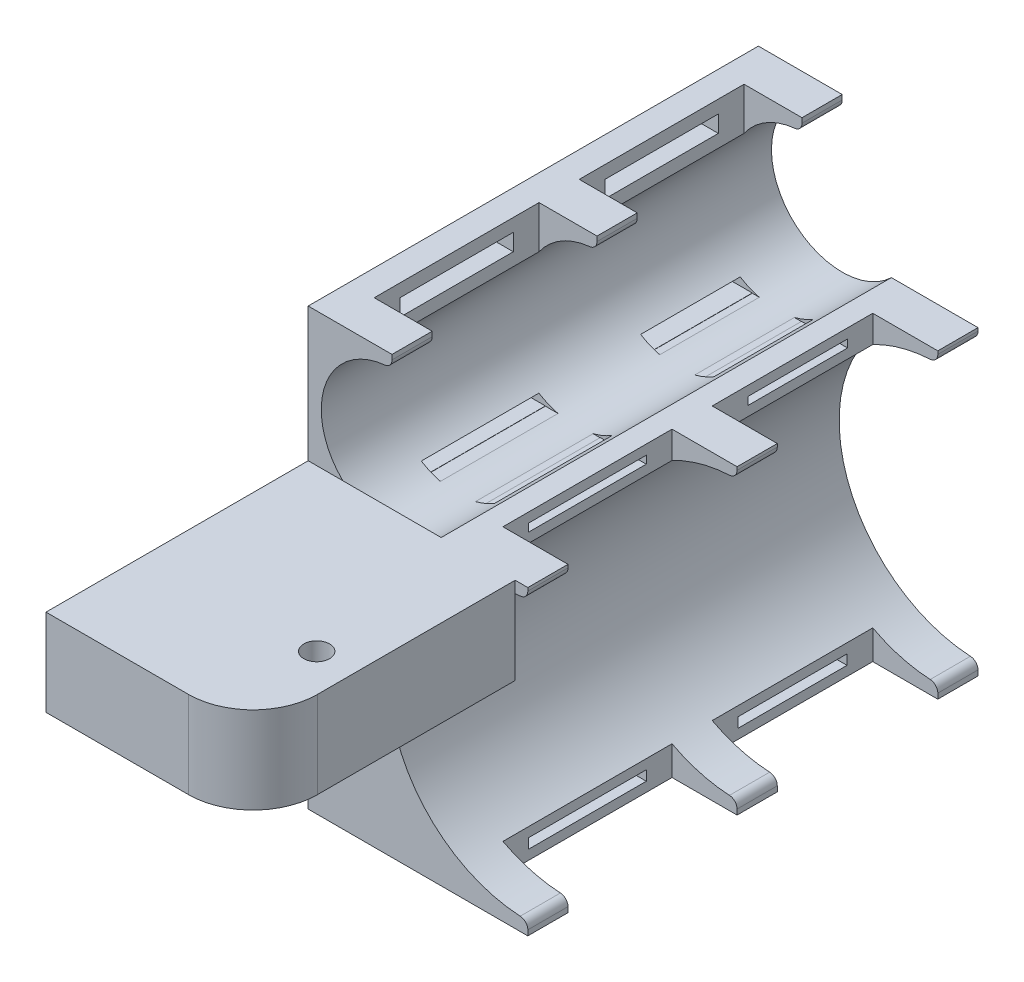
from build123d import *

# Parameters (mm, degrees)
BOSS_EXTRUDE1_DEPTH = 70
SKETCH2_W           = 30.127897987
SKETCH2_H           = 25.625
CUT_EXTRUDE1_DEPTH  = 10
SKETCH3_W           = 36.135462637
SKETCH3_H           = 24.960917338
SKETCH3_H_2         = 26.289082662
CUT_EXTRUDE2_DEPTH  = 88.210896549
SKETCH5_W           = 40.769231001
SKETCH5_H           = 13.5
BOSS_EXTRUDE2_DEPTH = 50
SKETCH6_R           = 2
CUT_EXTRUDE3_DEPTH  = 50
FILLET1_R           = 1.25
FILLET2_R           = 16
SKETCH7_W           = 19.805527333
SKETCH7_H           = 40.769231001
CUT_EXTRUDE4_DEPTH  = 93.57213387
FILLET3_R           = 10
SKETCH9_W           = 15.47666937
SKETCH9_H           = 1.215437552
SKETCH9_W_2         = 18.289082662
SKETCH9_W_3         = 17.625
SKETCH9_H_2         = 2.622507707
SKETCH9_W_4         = 16.960917338
SKETCH9_H_3         = 1.548156683
CUT_EXTRUDE5_DEPTH  = 129.948187004
SKETCH10_W          = 7.652135561
SKETCH10_H          = 15.47666937
SKETCH10_W_2        = 8.528334289
SKETCH10_H_2        = 18.289082662
CUT_EXTRUDE8_DEPTH  = 2.75


with BuildPart() as part:
    # Sketch1 → Boss-Extrude1 (new body)
    with BuildSketch(Plane.XY):
        with BuildLine():
            Line((22.473811518, 84.75800041), (22.473811518, 83.058719541))
            ThreePointArc((22.473811518, 83.058719541), (0.883811518, 61.468719541), (22.473811518, 39.878719541))
            Line((22.473811518, 39.878719541), (22.473811518, 37.846719541))
            Line((22.473811518, 37.846719541), (-11.673355367, 37.846719541))
            Line((-11.673355367, 37.846719541), (-11.673355367, 105.594024014))
            Line((-11.673355367, 105.594024014), (1.358644633, 105.594024014))
            Line((1.358644633, 105.594024014), (1.358644633, 103.665116534))
            ThreePointArc((1.358644633, 103.665116534), (-8.83886186, 88.540693991), (9.005703845, 84.75800041))
            Line((9.005703845, 84.75800041), (22.473811518, 84.75800041))
        make_face()
    extrude(amount=-BOSS_EXTRUDE1_DEPTH)

    # Sketch2 → Cut-Extrude1 (cut)
    with BuildSketch(Plane(origin=(0, 105.594024014, 0), x_dir=(1, 0, 0), z_dir=(0, 1, 0))):
        with Locations((7.409862525, 50.9375)):
            Rectangle(SKETCH2_W, SKETCH2_H)
        with Locations((7.409862525, 19.0625)):
            Rectangle(SKETCH2_W, SKETCH2_H)
    extrude(amount=-CUT_EXTRUDE1_DEPTH, mode=Mode.SUBTRACT)

    # Sketch3 → Cut-Extrude2 (cut, through all)
    with BuildSketch(Plane(origin=(0, 84.75800041, 0), x_dir=(1, 0, 0), z_dir=(0, 1, 0))):
        with Locations((30.426375951, 51.269541331)):
            Rectangle(SKETCH3_W, SKETCH3_H)
        with Locations((30.426375951, 19.394541331)):
            Rectangle(SKETCH3_W, SKETCH3_H_2)
    extrude(amount=-CUT_EXTRUDE2_DEPTH, mode=Mode.SUBTRACT)

    # Sketch5 → Boss-Extrude2 (add)
    with BuildSketch(Plane.ZY.offset(11.673355367)):
        with Locations((20.384615501, 78.00800041)):
            Rectangle(SKETCH5_W, SKETCH5_H)
    extrude(amount=-BOSS_EXTRUDE2_DEPTH)

    # Sketch6 → Cut-Extrude3 (cut)
    with BuildSketch(Plane(origin=(0, 84.75800041, 0), x_dir=(1, 0, 0), z_dir=(0, 1, 0))):
        with Locations(Location((14.647627353, -25, 0), (0, 0, 270))):
            Circle(SKETCH6_R)
        with Locations(Location((30.329421103, -25, 0), (0, 0, 270))):
            Circle(SKETCH6_R)
    extrude(amount=-CUT_EXTRUDE3_DEPTH, mode=Mode.SUBTRACT)

    # Fillet1
    fillet1_edges = [part.edges().sort_by_distance(p)[0] for p in [
        (1.358644633, 103.665116534, -66.875),
        (22.473811518, 83.058719541, -66.875),
        (22.473811518, 39.878719541, -66.875),
        (1.358644633, 103.665116534, -35),
        (1.358644633, 103.665116534, -3.125),
        (22.473811518, 39.878719541, -35.664082662),
        (22.473811518, 39.878719541, -3.125),
        (22.473811518, 83.058719541, -35.664082662),
        (22.473811518, 83.058719541, -3.125),
    ]]
    fillet(fillet1_edges, radius=FILLET1_R)

    # Fillet2
    fillet2_edges = [part.edges().sort_by_distance(p)[0] for p in [
        (38.326644633, 78.00800041, 0),
        (38.326644633, 78.00800041, 40.769231001),
    ]]
    fillet(fillet2_edges, radius=FILLET2_R)

    # Sketch7 → Cut-Extrude4 (cut, through all)
    with BuildSketch(Plane(origin=(0, 84.75800041, 0), x_dir=(1, 0, 0), z_dir=(0, 1, 0))):
        with Locations((30.410801799, -20.384615501)):
            Rectangle(SKETCH7_W, SKETCH7_H)
    extrude(amount=-CUT_EXTRUDE4_DEPTH, mode=Mode.SUBTRACT)

    # Fillet3
    fillet3_edges = [part.edges().sort_by_distance(p)[0] for p in [
        (20.508038132, 78.00800041, 40.769231001),
    ]]
    fillet(fillet3_edges, radius=FILLET3_R)

    # Sketch9 → Cut-Extrude5 (cut, through all)
    with BuildSketch(Plane(origin=(12.358644633, 0, 0), x_dir=(0, 0, -1), z_dir=(1, 0, 0))):
        with Locations((52.096633222, 82.650281634)):
            Rectangle(SKETCH9_W, SKETCH9_H)
        with Locations((19.394541331, 82.650281634)):
            Rectangle(SKETCH9_W_2, SKETCH9_H)
        with Locations((50.9375, 102.282770161)):
            Rectangle(SKETCH9_W_3, SKETCH9_H_2)
        with Locations((19.0625, 102.282770161)):
            Rectangle(SKETCH9_W_3, SKETCH9_H_2)
        with Locations((51.269541331, 40.120797882)):
            Rectangle(SKETCH9_W_4, SKETCH9_H_3)
        with Locations((19.394541331, 40.120797882)):
            Rectangle(SKETCH9_W_2, SKETCH9_H_3)
    extrude(amount=-CUT_EXTRUDE5_DEPTH, mode=Mode.SUBTRACT)

    # Sketch10 → Cut-Extrude8 (cut)
    with BuildSketch(Plane(origin=(0, 84.75800041, 0), x_dir=(1, 0, 0), z_dir=(0, 1, 0))):
        with Locations((1.369713925, 52.096633222)):
            Rectangle(SKETCH10_W, SKETCH10_H)
        with Locations((0.931614561, 19.394541331)):
            Rectangle(SKETCH10_W_2, SKETCH10_H_2)
    extrude(amount=-CUT_EXTRUDE8_DEPTH, mode=Mode.SUBTRACT)


solid = part.part
